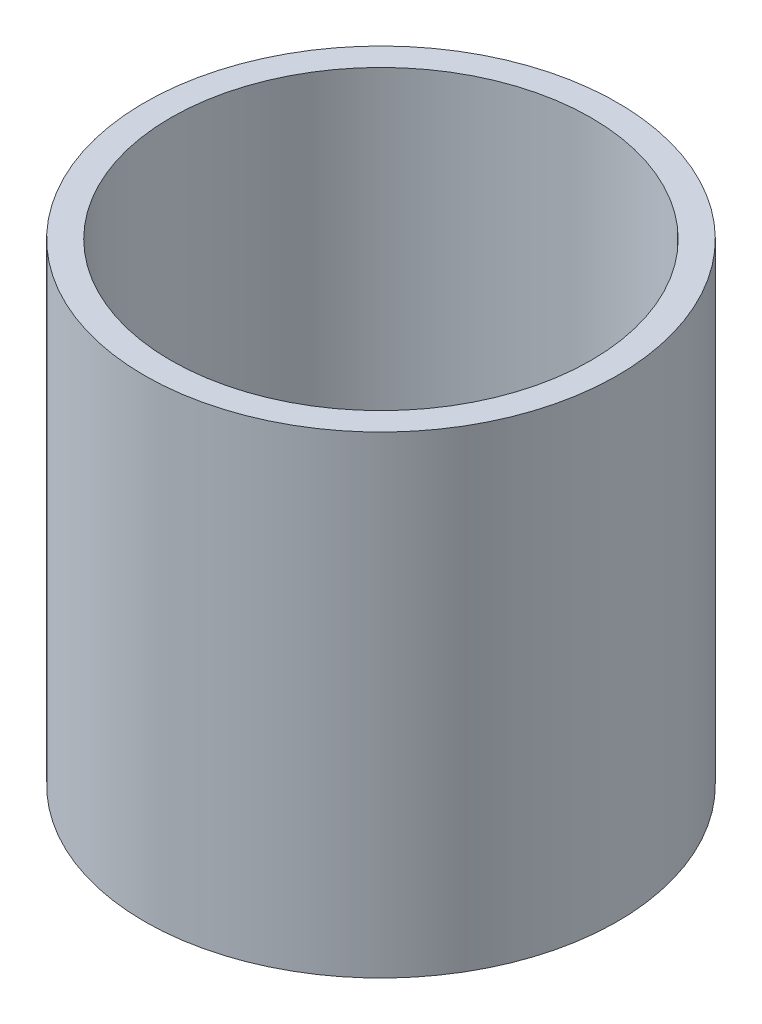
from build123d import *

# Parameters (mm, degrees)
SKETCH1_R           = 1
SKETCH1_R_2         = 0.889
BOSS_EXTRUDE1_DEPTH = 2


with BuildPart() as part:
    # Sketch1 → Boss-Extrude1 (new body)
    with BuildSketch(Plane(origin=(0, 0, 0), x_dir=(1, 0, 0), z_dir=(0, 1, 0))):
        with Locations(Location((0, 0, 0), (0, 0, 270))):
            Circle(SKETCH1_R)
        with Locations(Location((0, 0, 0), (0, 0, 270))):
            Circle(SKETCH1_R_2, mode=Mode.SUBTRACT)
    extrude(amount=BOSS_EXTRUDE1_DEPTH)


solid = part.part
